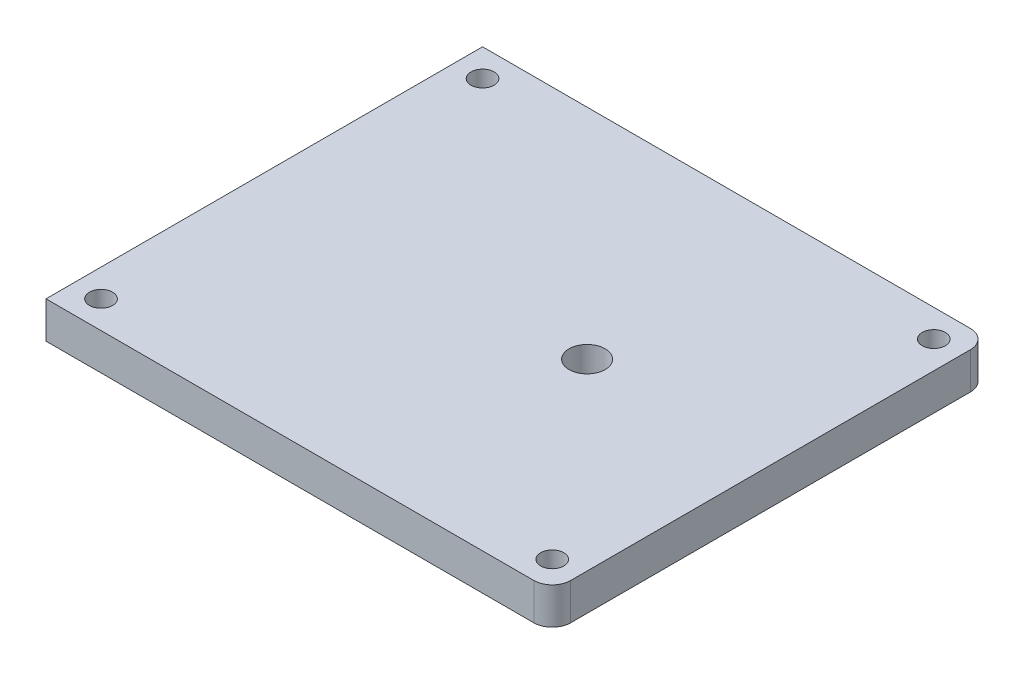
from build123d import *

# Parameters (mm, degrees)
SKETCH1_W                  = 35.052
SKETCH1_H                  = 30.226
BOSS_EXTRUDE1_DEPTH        = 2.54
F_1_6_1_6_DIAMETER_HOLE1_D = 1.6
F_2_5_2_5_DIAMETER_HOLE1_D = 2.5
FILLET1_R                  = 1.27


with BuildPart() as part:
    # Sketch1 → Boss-Extrude1 (new body)
    with BuildSketch(Plane(origin=(0, 0, 0), x_dir=(1, 0, 0), z_dir=(0, 1, 0))):
        with Locations((30.56522406, 8.548665099)):
            Rectangle(SKETCH1_W, SKETCH1_H)
    extrude(amount=BOSS_EXTRUDE1_DEPTH)

    # Ø1.6 (1.6) Diameter Hole1 (through all)
    with Locations(Plane(origin=(0, 0, 0), x_dir=(-1, 0, 0), z_dir=(0, -1, 0))):
        with Locations((-14.94422406, -4.659334901), (-46.18622406, -4.659334901), (-46.18622406, 21.756665099), (-14.94422406, 21.756665099)):
            Hole(F_1_6_1_6_DIAMETER_HOLE1_D / 2)

    # Ø2.5 (2.5) Diameter Hole1 (through all)
    with Locations(Plane(origin=(0, 2.54, 0), x_dir=(1, 0, 0), z_dir=(0, 1, 0))):
        with Locations((35.39122406, 8.548665099)):
            Hole(F_2_5_2_5_DIAMETER_HOLE1_D / 2)

    # Fillet1
    fillet1_edges = [part.edges().sort_by_distance(p)[0] for p in [
        (48.09122406, 1.27, -23.661665099),
        (48.09122406, 1.27, 6.564334901),
    ]]
    fillet(fillet1_edges, radius=FILLET1_R)


solid = part.part
